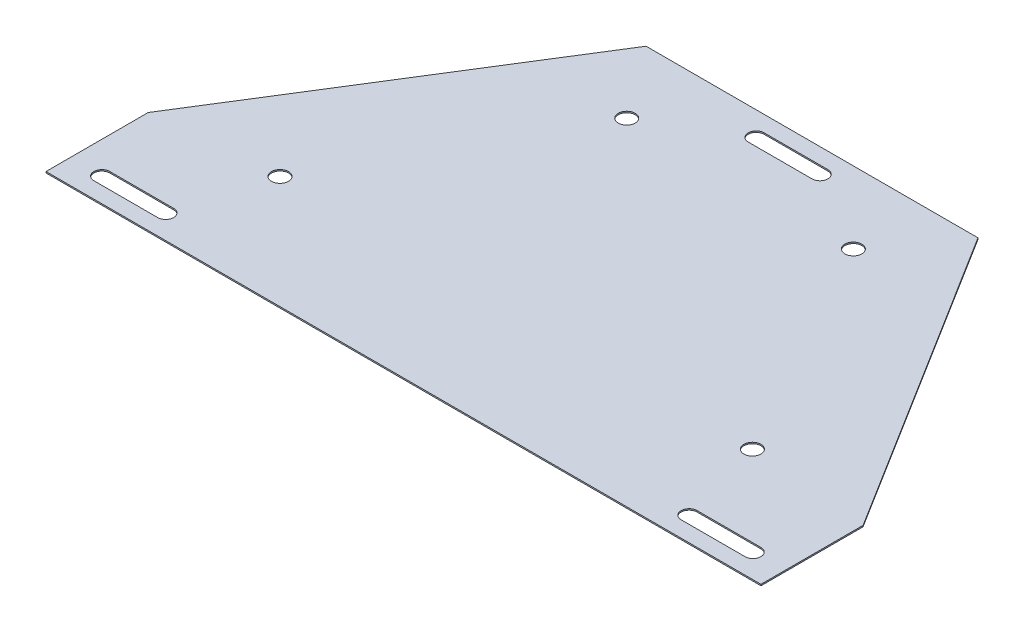
from build123d import *

# Parameters (mm, degrees)
BOSS_EXTRUDE1_DEPTH = 2.65684
CUT_EXTRUDE1_DEPTH  = 1081.026082462
SKETCH3_R           = 16.891
CUT_EXTRUDE2_DEPTH  = 1081.026082462


with BuildPart() as part:
    # Sketch1 → Boss-Extrude1 (new body)
    with BuildSketch(Plane(origin=(0, 0, 0), x_dir=(1, 0, 0), z_dir=(0, 1, 0))):
        Polygon((-711.2, 203.2), (-711.2, 0), (0, 0), (0, 812.8), (-330.2, 812.8), align=None)
        Polygon((0, 812.8), (0, 0), (711.2, 0), (711.2, 203.2), (330.2, 812.8), align=None)
    extrude(amount=BOSS_EXTRUDE1_DEPTH)

    # Sketch2 → Cut-Extrude1 (cut, through all)
    with BuildSketch(Plane(origin=(0, 2.65684, 0), x_dir=(1, 0, 0), z_dir=(0, 1, 0))):
        with BuildLine():
            Line((-63.5, 781.05), (63.5, 781.05))
            ThreePointArc((63.5, 781.05), (79.375, 765.175), (63.5, 749.3))
            Line((63.5, 749.3), (-63.5, 749.3))
            ThreePointArc((-63.5, 749.3), (-79.375, 765.175), (-63.5, 781.05))
        make_face()
        with BuildLine():
            Line((-647.7, 63.5), (-520.7, 63.5))
            ThreePointArc((-520.7, 63.5), (-504.825, 47.625), (-520.7, 31.75))
            Line((-520.7, 31.75), (-647.7, 31.75))
            ThreePointArc((-647.7, 31.75), (-663.575, 47.625), (-647.7, 63.5))
        make_face()
        with BuildLine():
            Line((520.7, 63.5), (647.7, 63.5))
            ThreePointArc((647.7, 63.5), (663.575, 47.625), (647.7, 31.75))
            Line((647.7, 31.75), (520.7, 31.75))
            ThreePointArc((520.7, 31.75), (504.825, 47.625), (520.7, 63.5))
        make_face()
    extrude(amount=-CUT_EXTRUDE1_DEPTH, mode=Mode.SUBTRACT)

    # Sketch3 → Cut-Extrude2 (cut, through all)
    with BuildSketch(Plane(origin=(0, 2.65684, 0), x_dir=(1, 0, 0), z_dir=(0, 1, 0))):
        with Locations(Location((-469.9, 224.282, 0), (0, 0, 270))):
            Circle(SKETCH3_R)
        with Locations(Location((-225.425, 669.586361505, 0), (0, 0, 270))):
            Circle(SKETCH3_R)
        with Locations(Location((225.425, 669.586361505, 0), (0, 0, 270))):
            Circle(SKETCH3_R)
        with Locations(Location((469.9, 224.282, 0), (0, 0, 270))):
            Circle(SKETCH3_R)
    extrude(amount=-CUT_EXTRUDE2_DEPTH, mode=Mode.SUBTRACT)


solid = part.part
